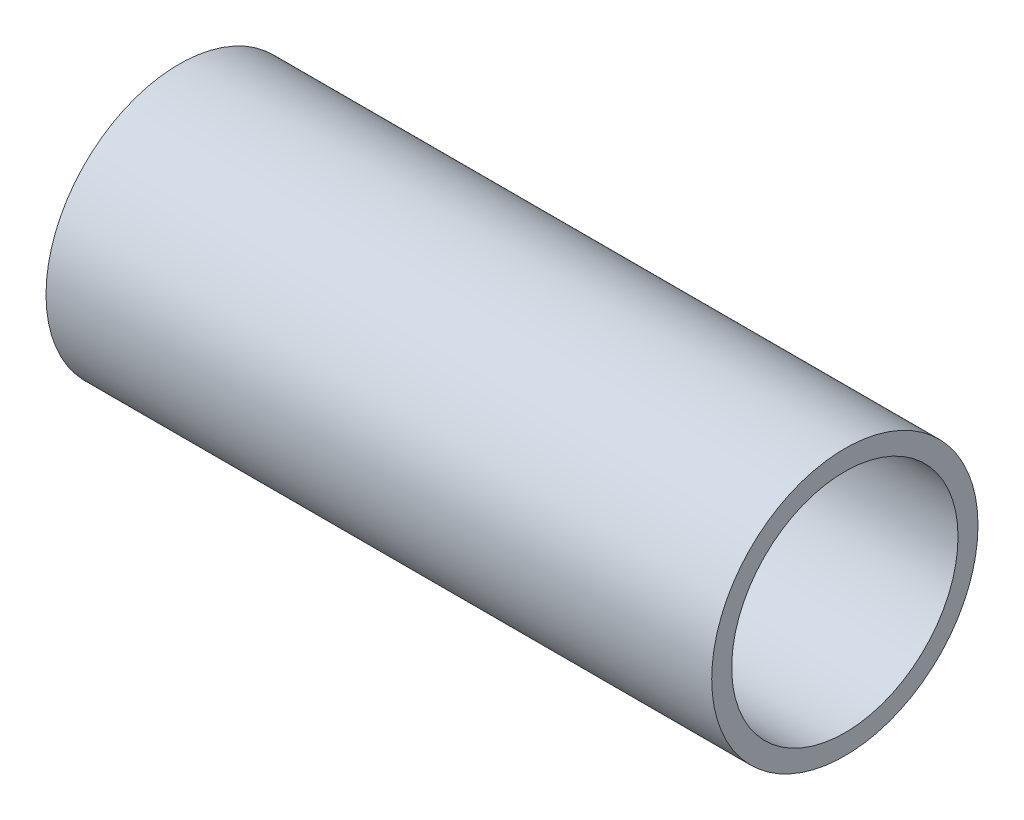
from build123d import *

# Parameters (mm, degrees)
SKETCH1_R           = 20
BOSS_EXTRUDE1_DEPTH = 100
SKETCH2_R           = 17
CUT_EXTRUDE1_DEPTH  = 95


with BuildPart() as part:
    # Sketch1 → Boss-Extrude1 (new body)
    with BuildSketch(Plane(origin=(0, 0, 0), x_dir=(0, 0, -1), z_dir=(1, 0, 0))):
        Circle(SKETCH1_R)
    extrude(amount=BOSS_EXTRUDE1_DEPTH)

    # Sketch2 → Cut-Extrude1 (cut)
    with BuildSketch(Plane(origin=(100, 0, 0), x_dir=(0, 0, -1), z_dir=(1, 0, 0))):
        Circle(SKETCH2_R)
    extrude(amount=-CUT_EXTRUDE1_DEPTH, mode=Mode.SUBTRACT)


solid = part.part
